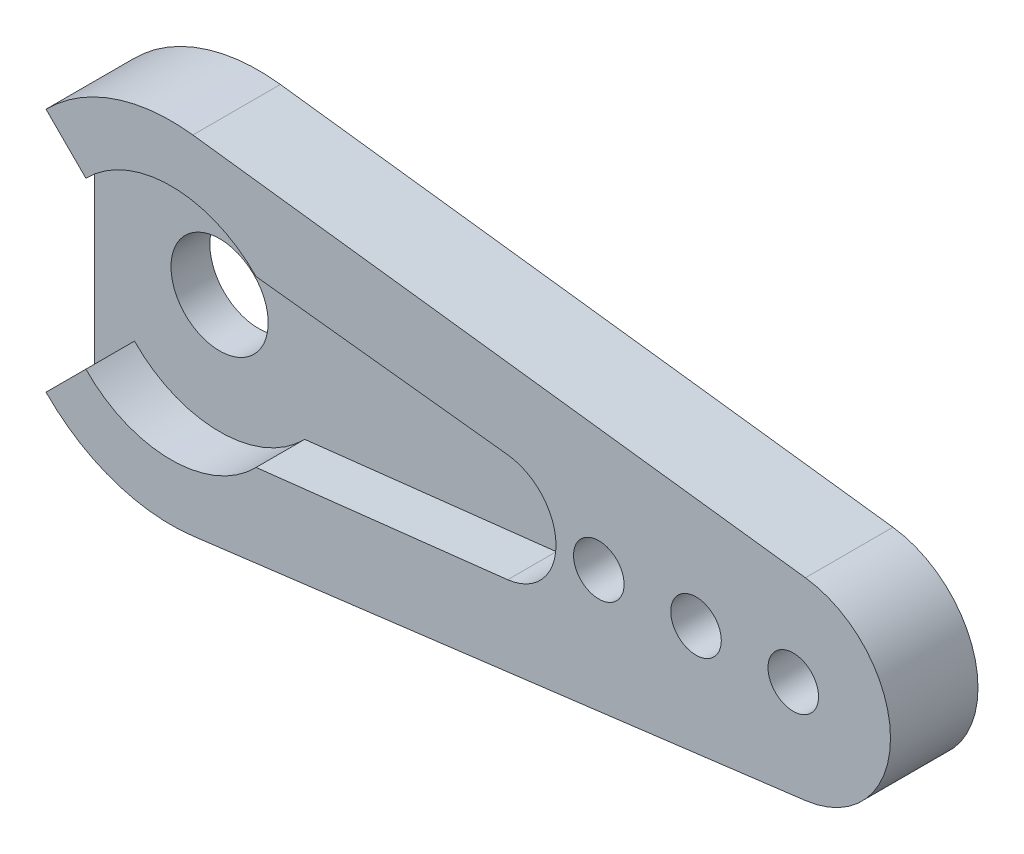
from build123d import *

# Parameters (mm, degrees)
MAIN_DEPTH            = 2.5
ORIGINALBRACKET_START = 2
ESQUISSE2_R           = 2.5
ORIGINALBRACKET_DEPTH = 2
ESQUISSE3_R           = 1.3
FIXINGHOLE_DEPTH      = 39.34383914


with BuildPart() as part:
    # Esquisse1 → Main (new body)
    with BuildSketch(Plane.XY):
        with BuildLine():
            Line((-4.375785644, 4.25), (-6.426543071, 6.300757427))
            ThreePointArc((-6.426543071, 6.300757427), (-2.958723408, 8.499762102), (1.125, 8.929410675))
            Line((1.125, 8.929410675), (32.625, 4.960783708))
            ThreePointArc((32.625, 4.960783708), (37, 0), (32.625, -4.960783708))
            Line((32.625, -4.960783708), (1.125, -8.929410675))
            ThreePointArc((1.125, -8.929410675), (-2.958723408, -8.499762102), (-6.426543071, -6.300757427))
            Line((-6.426543071, -6.300757427), (-4.375785644, -4.25))
            ThreePointArc((-4.375785644, -4.25), (0, -6.1), (4.375785644, -4.25))
            Line((4.375785644, -4.25), (17.31559729, -2.78215714))
            ThreePointArc((17.31559729, -2.78215714), (19.8, 0), (17.31559729, 2.78215714))
            Line((17.31559729, 2.78215714), (4.375785644, 4.25))
            ThreePointArc((4.375785644, 4.25), (0, 6.1), (-4.375785644, 4.25))
        make_face()
    extrude(amount=MAIN_DEPTH)

    # Esquisse2 → OriginalBracket (add)
    with BuildSketch(Plane(origin=(0, 0, 0), x_dir=(-1, 0, 0), z_dir=(0, 0, -1)).offset(ORIGINALBRACKET_START)):
        with BuildLine():
            Line((-1.125, -8.929410675), (-32.625, -4.960783708))
            ThreePointArc((-32.625, -4.960783708), (-37, 0), (-32.625, 4.960783708))
            Line((-32.625, 4.960783708), (-1.125, 8.929410675))
            ThreePointArc((-1.125, 8.929410675), (2.958723408, 8.499762102), (6.426543071, 6.300757427))
            Line((6.426543071, 6.300757427), (6.426543071, -6.300757427))
            ThreePointArc((6.426543071, -6.300757427), (2.958723408, -8.499762102), (-1.125, -8.929410675))
        make_face()
        Circle(ESQUISSE2_R, mode=Mode.SUBTRACT)
    extrude(amount=-ORIGINALBRACKET_DEPTH)

    # Esquisse3 → FixingHole (cut, through all)
    with BuildSketch(Plane.XY.offset(2.5)):
        with Locations((32, 0)):
            Circle(ESQUISSE3_R)
        with Locations((22, 0)):
            Circle(ESQUISSE3_R)
        with Locations((27, 0)):
            Circle(ESQUISSE3_R)
    extrude(amount=-FIXINGHOLE_DEPTH, mode=Mode.SUBTRACT)


solid = part.part
